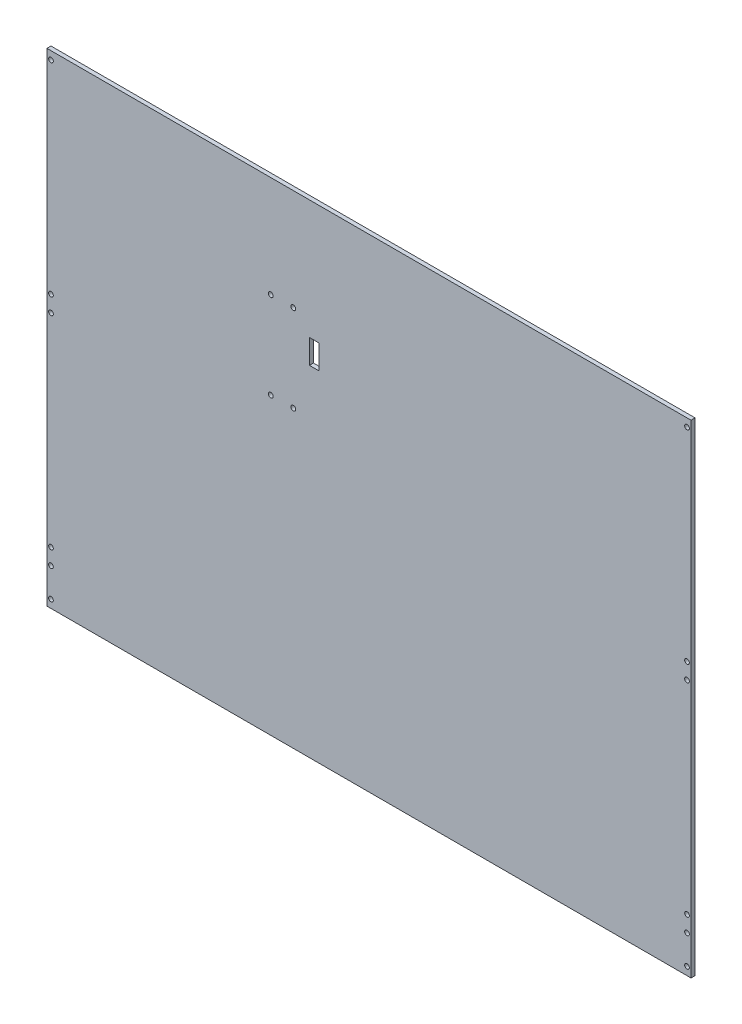
from build123d import *

# Parameters (mm, degrees)
SKETCH1_W           = 508
SKETCH1_H           = 381
BOSS_EXTRUDE1_DEPTH = 3.175
SKETCH3_W           = 7.62
SKETCH3_H           = 19.05
CUT_EXTRUDE2_DEPTH  = 3.175
SKETCH2_R           = 1.8542
SKETCH2_R_2         = 1.905
CUT_EXTRUDE1_DEPTH  = 3.175


with BuildPart() as part:
    # Sketch1 → Boss-Extrude1 (new body)
    with BuildSketch(Plane.XY):
        Rectangle(SKETCH1_W, SKETCH1_H)
    extrude(amount=BOSS_EXTRUDE1_DEPTH)

    # Sketch3 → Cut-Extrude2 (cut)
    with BuildSketch(Plane.XY.offset(3.175)):
        with Locations((-43.18, 86.995)):
            Rectangle(SKETCH3_W, SKETCH3_H)
    extrude(amount=-CUT_EXTRUDE2_DEPTH, mode=Mode.SUBTRACT)

    # Sketch2 → Cut-Extrude1 (cut)
    with BuildSketch(Plane.XY.offset(3.175)):
        with Locations((-250.825, -184.15)):
            Circle(SKETCH2_R)
        with Locations((-250.825, 184.15)):
            Circle(SKETCH2_R)
        with Locations((250.825, 184.15)):
            Circle(SKETCH2_R)
        with Locations((250.825, -184.15)):
            Circle(SKETCH2_R)
        with Locations((-250.825, 24.13)):
            Circle(SKETCH2_R)
        with Locations((250.825, 24.13)):
            Circle(SKETCH2_R)
        with Locations((-250.825, 11.43)):
            Circle(SKETCH2_R)
        with Locations((-250.825, -148.59)):
            Circle(SKETCH2_R)
        with Locations((-250.825, -161.29)):
            Circle(SKETCH2_R)
        with Locations(Location((250.825, -161.29, 0), (0, 0, 180))):
            Circle(SKETCH2_R)
        with Locations(Location((250.825, -148.59, 0), (0, 0, 180))):
            Circle(SKETCH2_R)
        with Locations(Location((250.825, 11.43, 0), (0, 0, 180))):
            Circle(SKETCH2_R)
        with Locations((-77.488669, 110.49)):
            Circle(SKETCH2_R_2)
        with Locations((-77.488669, 41.91)):
            Circle(SKETCH2_R_2)
        with Locations((-59.708669, 110.49)):
            Circle(SKETCH2_R_2)
        with Locations((-59.708669, 41.91)):
            Circle(SKETCH2_R_2)
    extrude(amount=-CUT_EXTRUDE1_DEPTH, mode=Mode.SUBTRACT)


solid = part.part
